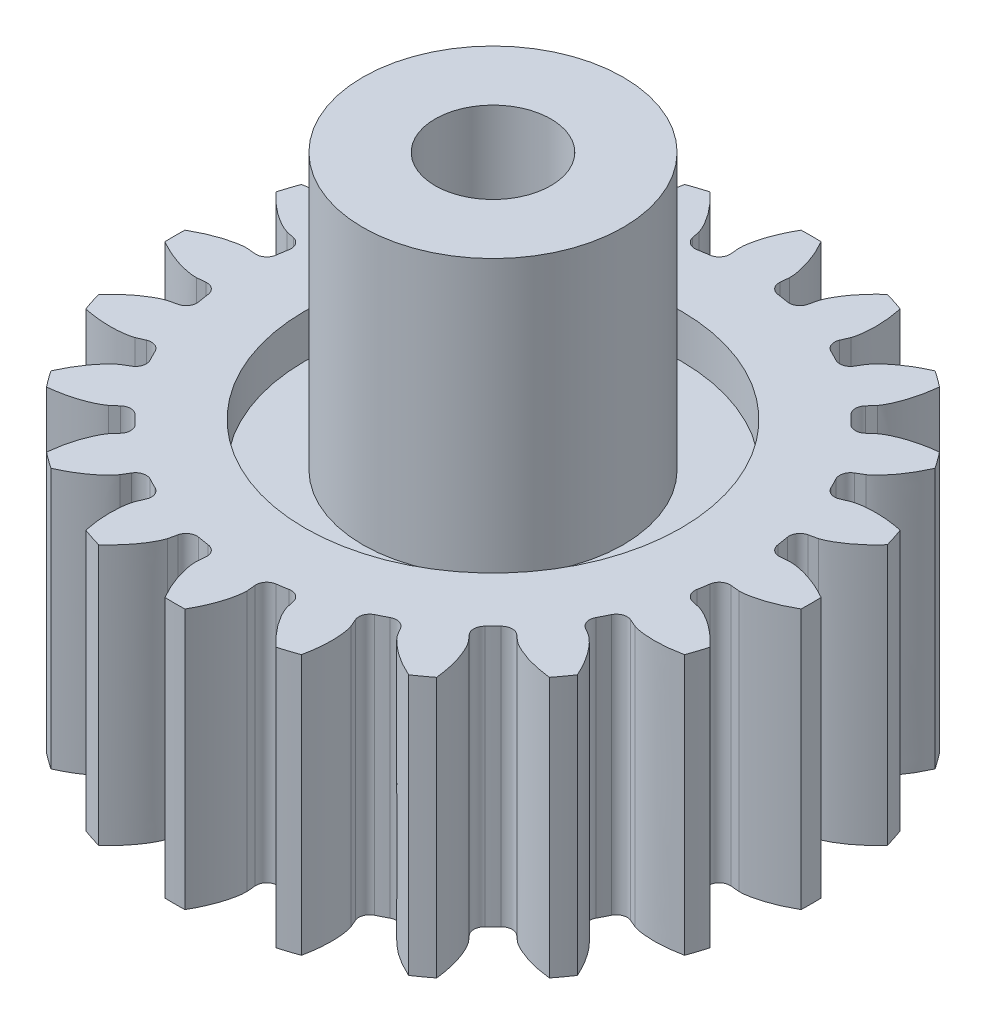
from build123d import *

# Parameters (mm, degrees)
BOSS_EXTRUDE1_DEPTH      = 4.5
BOSS_EXTRUDE1_DEPTH_BACK = 4.5
SKETCH3_R                = 4.5
BOSS_EXTRUDE2_DEPTH      = 8
CUT_EXTRUDE1_START       = -1.5
SKETCH4_R                = 6.5
SKETCH4_R_2              = 4.5
CUT_EXTRUDE1_DEPTH       = 1.5
SKETCH5_R                = 6.5
SKETCH5_R_2              = 4.5
CUT_EXTRUDE2_DEPTH       = 1.5
CUT_EXTRUDE3_REACH       = 25.043
SKETCH6_R                = 2


with BuildPart() as part:
    # Sketch1 → Boss-Extrude1 (new, two sides: drawn at the far end of the back side and taken through both)
    with BuildSketch(Plane(origin=(0, 0, 9), x_dir=(1, 0, 0), z_dir=(0, -1, 0)).offset(-BOSS_EXTRUDE1_DEPTH_BACK)):
        with BuildLine():
            Line((9.077514954, -9.850718674), (9.373356247, -9.877731455))
            add(Edge.make_bspline(
                [(9.373356247, -9.877731455), (9.508835237, -9.88009169), (9.644479833, -9.858420187), (9.777139327, -9.830823337), (9.988668533, -9.7868194), (10.195948863, -9.719946146), (10.396302265, -9.639079182), (10.602141578, -9.555997985), (10.802046528, -9.457086754), (10.99447564, -9.346437106)],
                knots=[0, 0, 0, 0, 0.000406499, 0.000406499, 0.000406499, 0.001055018, 0.001055018, 0.001055018, 0.001720678, 0.001720678, 0.001720678, 0.001720678], degree=3))
            ThreePointArc((10.99447564, -9.346437106), (10.999932388, -9), (10.99447564, -8.653562894))
            add(Edge.make_bspline(
                [(10.99447564, -8.653562894), (10.752270962, -8.514291543), (10.497928619, -8.39329861), (10.234747445, -8.299515432), (10.097780271, -8.250707926), (9.9578861, -8.209054212), (9.815942385, -8.177523892), (9.670805988, -8.145284374), (9.522007697, -8.119678827), (9.373356247, -8.122268545)],
                knots=[0, 0, 0, 0, 0.000838175, 0.000838175, 0.000838175, 0.001273222, 0.001273222, 0.001273222, 0.001719104, 0.001719104, 0.001719104, 0.001719104], degree=3))
            Line((9.373356247, -8.122268545), (9.077514954, -8.149281326))
            ThreePointArc((9.077514954, -8.149281326), (8.809362027, -8.069618554), (8.670954474, -7.826522896))
            ThreePointArc((8.670954474, -7.826522896), (8.64227298, -7.631198431), (8.609192122, -7.436570756))
            ThreePointArc((8.609192122, -7.436570756), (8.665704839, -7.162602761), (8.896116276, -7.003975151))
            Line((8.896116276, -7.003975151), (9.185825474, -6.938245845))
            add(Edge.make_bspline(
                [(9.185825474, -6.938245845), (9.315403003, -6.898625252), (9.437711817, -6.836097943), (9.555350598, -6.76885774), (9.742928864, -6.66164139), (9.9193992, -6.533988001), (10.084957342, -6.395166342), (10.25504866, -6.252543582), (10.414604315, -6.096699385), (10.563422654, -5.93200145)],
                knots=[0, 0, 0, 0, 0.000406499, 0.000406499, 0.000406499, 0.001055018, 0.001055018, 0.001055018, 0.001720678, 0.001720678, 0.001720678, 0.001720678], degree=3))
            ThreePointArc((10.563422654, -5.93200145), (10.461557376, -5.600833955), (10.349312748, -5.273038916))
            add(Edge.make_bspline(
                [(10.349312748, -5.273038916), (10.075925196, -5.215429352), (9.796642381, -5.178954341), (9.517361614, -5.171088694), (9.372015742, -5.166995181), (9.226096774, -5.170609821), (9.081356874, -5.184485726), (8.933361399, -5.198673735), (8.783933266, -5.220302613), (8.643357602, -5.268701406)],
                knots=[0, 0, 0, 0, 0.000838175, 0.000838175, 0.000838175, 0.001273222, 0.001273222, 0.001273222, 0.001719104, 0.001719104, 0.001719104, 0.001719104], degree=3))
            Line((8.643357602, -5.268701406), (8.370343221, -5.385812074))
            ThreePointArc((8.370343221, -5.385812074), (8.090697482, -5.392912087), (7.883943387, -5.204484664))
            ThreePointArc((7.883943387, -5.204484664), (7.796307087, -5.027583127), (7.704702062, -4.852703756))
            ThreePointArc((7.704702062, -4.852703756), (7.673788083, -4.57468132), (7.843903755, -4.352616448))
            Line((7.843903755, -4.352616448), (8.099122103, -4.200579097))
            add(Edge.make_bspline(
                [(8.099122103, -4.200579097), (8.210114219, -4.122856015), (8.307114813, -4.025593508), (8.398217576, -3.925291893), (8.543483434, -3.765358212), (8.671869631, -3.589420293), (8.786426529, -3.406232769), (8.904120129, -3.218029356), (9.007708068, -3.020507308), (9.098348259, -2.817882868)],
                knots=[0, 0, 0, 0, 0.000406499, 0.000406499, 0.000406499, 0.001055018, 0.001055018, 0.001055018, 0.001720678, 0.001720678, 0.001720678, 0.001720678], degree=3))
            ThreePointArc((9.098348259, -2.817882868), (8.899132239, -2.534401966), (8.691087015, -2.257335856))
            add(Edge.make_bspline(
                [(8.691087015, -2.257335856), (8.413277669, -2.287027304), (8.136392529, -2.338640643), (7.868350118, -2.417462472), (7.728853014, -2.458483654), (7.591192814, -2.507012822), (7.457824879, -2.56493668), (7.321457154, -2.624163396), (7.186026245, -2.690909514), (7.067286893, -2.78037977)],
                knots=[0, 0, 0, 0, 0.000838175, 0.000838175, 0.000838175, 0.001273222, 0.001273222, 0.001273222, 0.001719104, 0.001719104, 0.001719104, 0.001719104], degree=3))
            Line((7.067286893, -2.78037977), (6.843823974, -2.976124718))
            ThreePointArc((6.843823974, -2.976124718), (6.580059096, -3.069292517), (6.325196991, -2.953977918))
            ThreePointArc((6.325196991, -2.953977918), (6.187184335, -2.812815665), (6.046022082, -2.674803009))
            ThreePointArc((6.046022082, -2.674803009), (5.930707483, -2.419940904), (6.023875282, -2.156176026))
            Line((6.023875282, -2.156176026), (6.21962023, -1.932713107))
            add(Edge.make_bspline(
                [(6.21962023, -1.932713107), (6.301162252, -1.824495613), (6.363359531, -1.70201864), (6.419008504, -1.578473833), (6.50774232, -1.381478245), (6.575477042, -1.174477823), (6.627819068, -0.964856107), (6.681594281, -0.749494703), (6.719074596, -0.529629638), (6.742664144, -0.308912985)],
                knots=[0, 0, 0, 0, 0.000406499, 0.000406499, 0.000406499, 0.001055018, 0.001055018, 0.001055018, 0.001720678, 0.001720678, 0.001720678, 0.001720678], degree=3))
            ThreePointArc((6.742664144, -0.308912985), (6.465598034, -0.100867761), (6.182117132, 0.098348259))
            add(Edge.make_bspline(
                [(6.182117132, 0.098348259), (5.927079905, -0.015737796), (5.679695887, -0.150387212), (5.449129689, -0.308180886), (5.329136303, -0.390301325), (5.21321001, -0.478994648), (5.104269023, -0.575296468), (4.992877671, -0.673764367), (4.884700907, -0.77909415), (4.799420903, -0.900877897)],
                knots=[0, 0, 0, 0, 0.000838175, 0.000838175, 0.000838175, 0.001273222, 0.001273222, 0.001273222, 0.001719104, 0.001719104, 0.001719104, 0.001719104], degree=3))
            Line((4.799420903, -0.900877897), (4.647383552, -1.156096245))
            ThreePointArc((4.647383552, -1.156096245), (4.42531868, -1.326211917), (4.147296244, -1.295297938))
            ThreePointArc((4.147296244, -1.295297938), (3.972416873, -1.203692913), (3.795515336, -1.116056613))
            ThreePointArc((3.795515336, -1.116056613), (3.607087913, -0.909302518), (3.614187926, -0.629656779))
            Line((3.614187926, -0.629656779), (3.731298594, -0.356642398))
            add(Edge.make_bspline(
                [(3.731298594, -0.356642398), (3.775408621, -0.228523575), (3.796714283, -0.092821035), (3.811462156, 0.041873537), (3.834978046, 0.256647732), (3.835430946, 0.474448012), (3.820434499, 0.689984687), (3.805027431, 0.911423008), (3.772731287, 1.132109165), (3.726961084, 1.349312748)],
                knots=[0, 0, 0, 0, 0.000406499, 0.000406499, 0.000406499, 0.001055018, 0.001055018, 0.001055018, 0.001720678, 0.001720678, 0.001720678, 0.001720678], degree=3))
            ThreePointArc((3.726961084, 1.349312748), (3.399166045, 1.461557376), (3.06799855, 1.563422654))
            add(Edge.make_bspline(
                [(3.06799855, 1.563422654), (2.860698263, 1.376109531), (2.667031039, 1.171604461), (2.496510481, 0.950284885), (2.4077666, 0.835103711), (2.324921887, 0.714928154), (2.251071751, 0.589675063), (2.175560534, 0.461604706), (2.105227011, 0.328001671), (2.061754155, 0.185825474)],
                knots=[0, 0, 0, 0, 0.000838175, 0.000838175, 0.000838175, 0.001273222, 0.001273222, 0.001273222, 0.001719104, 0.001719104, 0.001719104, 0.001719104], degree=3))
            Line((2.061754155, 0.185825474), (1.996024849, -0.103883724))
            ThreePointArc((1.996024849, -0.103883724), (1.837397239, -0.334295161), (1.563429244, -0.390807878))
            ThreePointArc((1.563429244, -0.390807878), (1.368801569, -0.35772702), (1.173477104, -0.329045526))
            ThreePointArc((1.173477104, -0.329045526), (0.930381446, -0.190637973), (0.850718674, 0.077514954))
            Line((0.850718674, 0.077514954), (0.877731455, 0.373356247))
            add(Edge.make_bspline(
                [(0.877731455, 0.373356247), (0.88009169, 0.508835237), (0.858420187, 0.644479833), (0.830823337, 0.777139327), (0.7868194, 0.988668533), (0.719946146, 1.195948863), (0.639079182, 1.396302265), (0.555997985, 1.602141578), (0.457086754, 1.802046528), (0.346437106, 1.99447564)],
                knots=[0, 0, 0, 0, 0.000406499, 0.000406499, 0.000406499, 0.001055018, 0.001055018, 0.001055018, 0.001720678, 0.001720678, 0.001720678, 0.001720678], degree=3))
            ThreePointArc((0.346437106, 1.99447564), (0, 1.999932388), (-0.346437106, 1.99447564))
            add(Edge.make_bspline(
                [(-0.346437106, 1.99447564), (-0.485708457, 1.752270962), (-0.60670139, 1.497928619), (-0.700484568, 1.234747445), (-0.749292074, 1.097780271), (-0.790945788, 0.9578861), (-0.822476108, 0.815942385), (-0.854715626, 0.670805988), (-0.880321173, 0.522007697), (-0.877731455, 0.373356247)],
                knots=[0, 0, 0, 0, 0.000838175, 0.000838175, 0.000838175, 0.001273222, 0.001273222, 0.001273222, 0.001719104, 0.001719104, 0.001719104, 0.001719104], degree=3))
            Line((-0.877731455, 0.373356247), (-0.850718674, 0.077514954))
            ThreePointArc((-0.850718674, 0.077514954), (-0.930381446, -0.190637973), (-1.173477104, -0.329045526))
            ThreePointArc((-1.173477104, -0.329045526), (-1.368801569, -0.35772702), (-1.563429244, -0.390807878))
            ThreePointArc((-1.563429244, -0.390807878), (-1.837397239, -0.334295161), (-1.996024849, -0.103883724))
            Line((-1.996024849, -0.103883724), (-2.061754155, 0.185825474))
            add(Edge.make_bspline(
                [(-2.061754155, 0.185825474), (-2.101374748, 0.315403003), (-2.163902057, 0.437711817), (-2.23114226, 0.555350598), (-2.33835861, 0.742928864), (-2.466011999, 0.9193992), (-2.604833658, 1.084957342), (-2.747456418, 1.25504866), (-2.903300615, 1.414604315), (-3.06799855, 1.563422654)],
                knots=[0, 0, 0, 0, 0.000406499, 0.000406499, 0.000406499, 0.001055018, 0.001055018, 0.001055018, 0.001720678, 0.001720678, 0.001720678, 0.001720678], degree=3))
            ThreePointArc((-3.06799855, 1.563422654), (-3.399166045, 1.461557376), (-3.726961084, 1.349312748))
            add(Edge.make_bspline(
                [(-3.726961084, 1.349312748), (-3.784570648, 1.075925196), (-3.821045659, 0.796642381), (-3.828911306, 0.517361614), (-3.833004819, 0.372015742), (-3.829390179, 0.226096774), (-3.815514274, 0.081356874), (-3.801326265, -0.066638601), (-3.779697387, -0.216066734), (-3.731298594, -0.356642398)],
                knots=[0, 0, 0, 0, 0.000838175, 0.000838175, 0.000838175, 0.001273222, 0.001273222, 0.001273222, 0.001719104, 0.001719104, 0.001719104, 0.001719104], degree=3))
            Line((-3.731298594, -0.356642398), (-3.614187926, -0.629656779))
            ThreePointArc((-3.614187926, -0.629656779), (-3.607087913, -0.909302518), (-3.795515336, -1.116056613))
            ThreePointArc((-3.795515336, -1.116056613), (-3.972416873, -1.203692913), (-4.147296244, -1.295297938))
            ThreePointArc((-4.147296244, -1.295297938), (-4.42531868, -1.326211917), (-4.647383552, -1.156096245))
            Line((-4.647383552, -1.156096245), (-4.799420903, -0.900877897))
            add(Edge.make_bspline(
                [(-4.799420903, -0.900877897), (-4.877143985, -0.789885781), (-4.974406492, -0.692885187), (-5.074708107, -0.601782424), (-5.234641788, -0.456516566), (-5.410579707, -0.328130369), (-5.593767231, -0.213573471), (-5.781970644, -0.095879871), (-5.979492692, 0.007708068), (-6.182117132, 0.098348259)],
                knots=[0, 0, 0, 0, 0.000406499, 0.000406499, 0.000406499, 0.001055018, 0.001055018, 0.001055018, 0.001720678, 0.001720678, 0.001720678, 0.001720678], degree=3))
            ThreePointArc((-6.182117132, 0.098348259), (-6.465598034, -0.100867761), (-6.742664144, -0.308912985))
            add(Edge.make_bspline(
                [(-6.742664144, -0.308912985), (-6.712972696, -0.586722331), (-6.661359357, -0.863607471), (-6.582537528, -1.131649882), (-6.541516346, -1.271146986), (-6.492987178, -1.408807186), (-6.43506332, -1.542175121), (-6.375836604, -1.678542846), (-6.309090486, -1.813973755), (-6.21962023, -1.932713107)],
                knots=[0, 0, 0, 0, 0.000838175, 0.000838175, 0.000838175, 0.001273222, 0.001273222, 0.001273222, 0.001719104, 0.001719104, 0.001719104, 0.001719104], degree=3))
            Line((-6.21962023, -1.932713107), (-6.023875282, -2.156176026))
            ThreePointArc((-6.023875282, -2.156176026), (-5.930707483, -2.419940904), (-6.046022082, -2.674803009))
            ThreePointArc((-6.046022082, -2.674803009), (-6.187184335, -2.812815665), (-6.325196991, -2.953977918))
            ThreePointArc((-6.325196991, -2.953977918), (-6.580059096, -3.069292517), (-6.843823974, -2.976124718))
            Line((-6.843823974, -2.976124718), (-7.067286893, -2.78037977))
            add(Edge.make_bspline(
                [(-7.067286893, -2.78037977), (-7.175504387, -2.698837748), (-7.29798136, -2.636640469), (-7.421526167, -2.580991496), (-7.618521755, -2.49225768), (-7.825522177, -2.424522958), (-8.035143893, -2.372180932), (-8.250505297, -2.318405719), (-8.470370362, -2.280925404), (-8.691087015, -2.257335856)],
                knots=[0, 0, 0, 0, 0.000406499, 0.000406499, 0.000406499, 0.001055018, 0.001055018, 0.001055018, 0.001720678, 0.001720678, 0.001720678, 0.001720678], degree=3))
            ThreePointArc((-8.691087015, -2.257335856), (-8.899132239, -2.534401966), (-9.098348259, -2.817882868))
            add(Edge.make_bspline(
                [(-9.098348259, -2.817882868), (-8.984262204, -3.072920095), (-8.849612788, -3.320304113), (-8.691819114, -3.550870311), (-8.609698675, -3.670863697), (-8.521005352, -3.78678999), (-8.424703532, -3.895730977), (-8.326235633, -4.007122329), (-8.22090585, -4.115299093), (-8.099122103, -4.200579097)],
                knots=[0, 0, 0, 0, 0.000838175, 0.000838175, 0.000838175, 0.001273222, 0.001273222, 0.001273222, 0.001719104, 0.001719104, 0.001719104, 0.001719104], degree=3))
            Line((-8.099122103, -4.200579097), (-7.843903755, -4.352616448))
            ThreePointArc((-7.843903755, -4.352616448), (-7.673788083, -4.57468132), (-7.704702062, -4.852703756))
            ThreePointArc((-7.704702062, -4.852703756), (-7.796307087, -5.027583127), (-7.883943387, -5.204484664))
            ThreePointArc((-7.883943387, -5.204484664), (-8.090697482, -5.392912087), (-8.370343221, -5.385812074))
            Line((-8.370343221, -5.385812074), (-8.643357602, -5.268701406))
            add(Edge.make_bspline(
                [(-8.643357602, -5.268701406), (-8.771476425, -5.224591379), (-8.907178965, -5.203285717), (-9.041873537, -5.188537844), (-9.256647732, -5.165021954), (-9.474448012, -5.164569054), (-9.689984687, -5.179565501), (-9.911423008, -5.194972569), (-10.132109165, -5.227268713), (-10.349312748, -5.273038916)],
                knots=[0, 0, 0, 0, 0.000406499, 0.000406499, 0.000406499, 0.001055018, 0.001055018, 0.001055018, 0.001720678, 0.001720678, 0.001720678, 0.001720678], degree=3))
            ThreePointArc((-10.349312748, -5.273038916), (-10.461557376, -5.600833955), (-10.563422654, -5.93200145))
            add(Edge.make_bspline(
                [(-10.563422654, -5.93200145), (-10.376109531, -6.139301737), (-10.171604461, -6.332968961), (-9.950284885, -6.503489519), (-9.835103711, -6.5922334), (-9.714928154, -6.675078113), (-9.589675063, -6.748928249), (-9.461604706, -6.824439466), (-9.328001671, -6.894772989), (-9.185825474, -6.938245845)],
                knots=[0, 0, 0, 0, 0.000838175, 0.000838175, 0.000838175, 0.001273222, 0.001273222, 0.001273222, 0.001719104, 0.001719104, 0.001719104, 0.001719104], degree=3))
            Line((-9.185825474, -6.938245845), (-8.896116276, -7.003975151))
            ThreePointArc((-8.896116276, -7.003975151), (-8.665704839, -7.162602761), (-8.609192122, -7.436570756))
            ThreePointArc((-8.609192122, -7.436570756), (-8.64227298, -7.631198431), (-8.670954474, -7.826522896))
            ThreePointArc((-8.670954474, -7.826522896), (-8.809362027, -8.069618554), (-9.077514954, -8.149281326))
            Line((-9.077514954, -8.149281326), (-9.373356247, -8.122268545))
            add(Edge.make_bspline(
                [(-9.373356247, -8.122268545), (-9.508835237, -8.11990831), (-9.644479833, -8.141579813), (-9.777139327, -8.169176663), (-9.988668533, -8.2131806), (-10.195948863, -8.280053854), (-10.396302265, -8.360920818), (-10.602141578, -8.444002015), (-10.802046528, -8.542913246), (-10.99447564, -8.653562894)],
                knots=[0, 0, 0, 0, 0.000406499, 0.000406499, 0.000406499, 0.001055018, 0.001055018, 0.001055018, 0.001720678, 0.001720678, 0.001720678, 0.001720678], degree=3))
            ThreePointArc((-10.99447564, -8.653562894), (-10.999932388, -9), (-10.99447564, -9.346437106))
            add(Edge.make_bspline(
                [(-10.99447564, -9.346437106), (-10.752270962, -9.485708457), (-10.497928619, -9.60670139), (-10.234747445, -9.700484568), (-10.097780271, -9.749292074), (-9.9578861, -9.790945788), (-9.815942385, -9.822476108), (-9.670805988, -9.854715626), (-9.522007697, -9.880321173), (-9.373356247, -9.877731455)],
                knots=[0, 0, 0, 0, 0.000838175, 0.000838175, 0.000838175, 0.001273222, 0.001273222, 0.001273222, 0.001719104, 0.001719104, 0.001719104, 0.001719104], degree=3))
            Line((-9.373356247, -9.877731455), (-9.077514954, -9.850718674))
            ThreePointArc((-9.077514954, -9.850718674), (-8.809362027, -9.930381446), (-8.670954474, -10.173477104))
            ThreePointArc((-8.670954474, -10.173477104), (-8.64227298, -10.368801569), (-8.609192122, -10.563429244))
            ThreePointArc((-8.609192122, -10.563429244), (-8.665704839, -10.837397239), (-8.896116276, -10.996024849))
            Line((-8.896116276, -10.996024849), (-9.185825474, -11.061754155))
            add(Edge.make_bspline(
                [(-9.185825474, -11.061754155), (-9.315403003, -11.101374748), (-9.437711817, -11.163902057), (-9.555350598, -11.23114226), (-9.742928864, -11.33835861), (-9.9193992, -11.466011999), (-10.084957342, -11.604833658), (-10.25504866, -11.747456418), (-10.414604315, -11.903300615), (-10.563422654, -12.06799855)],
                knots=[0, 0, 0, 0, 0.000406499, 0.000406499, 0.000406499, 0.001055018, 0.001055018, 0.001055018, 0.001720678, 0.001720678, 0.001720678, 0.001720678], degree=3))
            ThreePointArc((-10.563422654, -12.06799855), (-10.461557376, -12.399166045), (-10.349312748, -12.726961084))
            add(Edge.make_bspline(
                [(-10.349312748, -12.726961084), (-10.075925196, -12.784570648), (-9.796642381, -12.821045659), (-9.517361614, -12.828911306), (-9.372015742, -12.833004819), (-9.226096774, -12.829390179), (-9.081356874, -12.815514274), (-8.933361399, -12.801326265), (-8.783933266, -12.779697387), (-8.643357602, -12.731298594)],
                knots=[0, 0, 0, 0, 0.000838175, 0.000838175, 0.000838175, 0.001273222, 0.001273222, 0.001273222, 0.001719104, 0.001719104, 0.001719104, 0.001719104], degree=3))
            Line((-8.643357602, -12.731298594), (-8.370343221, -12.614187926))
            ThreePointArc((-8.370343221, -12.614187926), (-8.090697482, -12.607087913), (-7.883943387, -12.795515336))
            ThreePointArc((-7.883943387, -12.795515336), (-7.796307087, -12.972416873), (-7.704702062, -13.147296244))
            ThreePointArc((-7.704702062, -13.147296244), (-7.673788083, -13.42531868), (-7.843903755, -13.647383552))
            Line((-7.843903755, -13.647383552), (-8.099122103, -13.799420903))
            add(Edge.make_bspline(
                [(-8.099122103, -13.799420903), (-8.210114219, -13.877143985), (-8.307114813, -13.974406492), (-8.398217576, -14.074708107), (-8.543483434, -14.234641788), (-8.671869631, -14.410579707), (-8.786426529, -14.593767231), (-8.904120129, -14.781970644), (-9.007708068, -14.979492692), (-9.098348259, -15.182117132)],
                knots=[0, 0, 0, 0, 0.000406499, 0.000406499, 0.000406499, 0.001055018, 0.001055018, 0.001055018, 0.001720678, 0.001720678, 0.001720678, 0.001720678], degree=3))
            ThreePointArc((-9.098348259, -15.182117132), (-8.899132239, -15.465598034), (-8.691087015, -15.742664144))
            add(Edge.make_bspline(
                [(-8.691087015, -15.742664144), (-8.413277669, -15.712972696), (-8.136392529, -15.661359357), (-7.868350118, -15.582537528), (-7.728853014, -15.541516346), (-7.591192814, -15.492987178), (-7.457824879, -15.43506332), (-7.321457154, -15.375836604), (-7.186026245, -15.309090486), (-7.067286893, -15.21962023)],
                knots=[0, 0, 0, 0, 0.000838175, 0.000838175, 0.000838175, 0.001273222, 0.001273222, 0.001273222, 0.001719104, 0.001719104, 0.001719104, 0.001719104], degree=3))
            Line((-7.067286893, -15.21962023), (-6.843823974, -15.023875282))
            ThreePointArc((-6.843823974, -15.023875282), (-6.580059096, -14.930707483), (-6.325196991, -15.046022082))
            ThreePointArc((-6.325196991, -15.046022082), (-6.187184335, -15.187184335), (-6.046022082, -15.325196991))
            ThreePointArc((-6.046022082, -15.325196991), (-5.930707483, -15.580059096), (-6.023875282, -15.843823974))
            Line((-6.023875282, -15.843823974), (-6.21962023, -16.067286893))
            add(Edge.make_bspline(
                [(-6.21962023, -16.067286893), (-6.301162252, -16.175504387), (-6.363359531, -16.29798136), (-6.419008504, -16.421526167), (-6.50774232, -16.618521755), (-6.575477042, -16.825522177), (-6.627819068, -17.035143893), (-6.681594281, -17.250505297), (-6.719074596, -17.470370362), (-6.742664144, -17.691087015)],
                knots=[0, 0, 0, 0, 0.000406499, 0.000406499, 0.000406499, 0.001055018, 0.001055018, 0.001055018, 0.001720678, 0.001720678, 0.001720678, 0.001720678], degree=3))
            ThreePointArc((-6.742664144, -17.691087015), (-6.465598034, -17.899132239), (-6.182117132, -18.098348259))
            add(Edge.make_bspline(
                [(-6.182117132, -18.098348259), (-5.927079905, -17.984262204), (-5.679695887, -17.849612788), (-5.449129689, -17.691819114), (-5.329136303, -17.609698675), (-5.21321001, -17.521005352), (-5.104269023, -17.424703532), (-4.992877671, -17.326235633), (-4.884700907, -17.22090585), (-4.799420903, -17.099122103)],
                knots=[0, 0, 0, 0, 0.000838175, 0.000838175, 0.000838175, 0.001273222, 0.001273222, 0.001273222, 0.001719104, 0.001719104, 0.001719104, 0.001719104], degree=3))
            Line((-4.799420903, -17.099122103), (-4.647383552, -16.843903755))
            ThreePointArc((-4.647383552, -16.843903755), (-4.42531868, -16.673788083), (-4.147296244, -16.704702062))
            ThreePointArc((-4.147296244, -16.704702062), (-3.972416873, -16.796307087), (-3.795515336, -16.883943387))
            ThreePointArc((-3.795515336, -16.883943387), (-3.607087913, -17.090697482), (-3.614187926, -17.370343221))
            Line((-3.614187926, -17.370343221), (-3.731298594, -17.643357602))
            add(Edge.make_bspline(
                [(-3.731298594, -17.643357602), (-3.775408621, -17.771476425), (-3.796714283, -17.907178965), (-3.811462156, -18.041873537), (-3.834978046, -18.256647732), (-3.835430946, -18.474448012), (-3.820434499, -18.689984687), (-3.805027431, -18.911423008), (-3.772731287, -19.132109165), (-3.726961084, -19.349312748)],
                knots=[0, 0, 0, 0, 0.000406499, 0.000406499, 0.000406499, 0.001055018, 0.001055018, 0.001055018, 0.001720678, 0.001720678, 0.001720678, 0.001720678], degree=3))
            ThreePointArc((-3.726961084, -19.349312748), (-3.399166045, -19.461557376), (-3.06799855, -19.563422654))
            add(Edge.make_bspline(
                [(-3.06799855, -19.563422654), (-2.860698263, -19.376109531), (-2.667031039, -19.171604461), (-2.496510481, -18.950284885), (-2.4077666, -18.835103711), (-2.324921887, -18.714928154), (-2.251071751, -18.589675063), (-2.175560534, -18.461604706), (-2.105227011, -18.328001671), (-2.061754155, -18.185825474)],
                knots=[0, 0, 0, 0, 0.000838175, 0.000838175, 0.000838175, 0.001273222, 0.001273222, 0.001273222, 0.001719104, 0.001719104, 0.001719104, 0.001719104], degree=3))
            Line((-2.061754155, -18.185825474), (-1.996024849, -17.896116276))
            ThreePointArc((-1.996024849, -17.896116276), (-1.837397239, -17.665704839), (-1.563429244, -17.609192122))
            ThreePointArc((-1.563429244, -17.609192122), (-1.368801569, -17.64227298), (-1.173477104, -17.670954474))
            ThreePointArc((-1.173477104, -17.670954474), (-0.930381446, -17.809362027), (-0.850718674, -18.077514954))
            Line((-0.850718674, -18.077514954), (-0.877731455, -18.373356247))
            add(Edge.make_bspline(
                [(-0.877731455, -18.373356247), (-0.88009169, -18.508835237), (-0.858420187, -18.644479833), (-0.830823337, -18.777139327), (-0.7868194, -18.988668533), (-0.719946146, -19.195948863), (-0.639079182, -19.396302265), (-0.555997985, -19.602141578), (-0.457086754, -19.802046528), (-0.346437106, -19.99447564)],
                knots=[0, 0, 0, 0, 0.000406499, 0.000406499, 0.000406499, 0.001055018, 0.001055018, 0.001055018, 0.001720678, 0.001720678, 0.001720678, 0.001720678], degree=3))
            ThreePointArc((-0.346437106, -19.99447564), (0, -19.999932388), (0.346437106, -19.99447564))
            add(Edge.make_bspline(
                [(0.346437106, -19.99447564), (0.485708457, -19.752270962), (0.60670139, -19.497928619), (0.700484568, -19.234747445), (0.749292074, -19.097780271), (0.790945788, -18.9578861), (0.822476108, -18.815942385), (0.854715626, -18.670805988), (0.880321173, -18.522007697), (0.877731455, -18.373356247)],
                knots=[0, 0, 0, 0, 0.000838175, 0.000838175, 0.000838175, 0.001273222, 0.001273222, 0.001273222, 0.001719104, 0.001719104, 0.001719104, 0.001719104], degree=3))
            Line((0.877731455, -18.373356247), (0.850718674, -18.077514954))
            ThreePointArc((0.850718674, -18.077514954), (0.930381446, -17.809362027), (1.173477104, -17.670954474))
            ThreePointArc((1.173477104, -17.670954474), (1.368801569, -17.64227298), (1.563429244, -17.609192122))
            ThreePointArc((1.563429244, -17.609192122), (1.837397239, -17.665704839), (1.996024849, -17.896116276))
            Line((1.996024849, -17.896116276), (2.061754155, -18.185825474))
            add(Edge.make_bspline(
                [(2.061754155, -18.185825474), (2.101374748, -18.315403003), (2.163902057, -18.437711817), (2.23114226, -18.555350598), (2.33835861, -18.742928864), (2.466011999, -18.9193992), (2.604833658, -19.084957342), (2.747456418, -19.25504866), (2.903300615, -19.414604315), (3.06799855, -19.563422654)],
                knots=[0, 0, 0, 0, 0.000406499, 0.000406499, 0.000406499, 0.001055018, 0.001055018, 0.001055018, 0.001720678, 0.001720678, 0.001720678, 0.001720678], degree=3))
            ThreePointArc((3.06799855, -19.563422654), (3.399166045, -19.461557376), (3.726961084, -19.349312748))
            add(Edge.make_bspline(
                [(3.726961084, -19.349312748), (3.784570648, -19.075925196), (3.821045659, -18.796642381), (3.828911306, -18.517361614), (3.833004819, -18.372015742), (3.829390179, -18.226096774), (3.815514274, -18.081356874), (3.801326265, -17.933361399), (3.779697387, -17.783933266), (3.731298594, -17.643357602)],
                knots=[0, 0, 0, 0, 0.000838175, 0.000838175, 0.000838175, 0.001273222, 0.001273222, 0.001273222, 0.001719104, 0.001719104, 0.001719104, 0.001719104], degree=3))
            Line((3.731298594, -17.643357602), (3.614187926, -17.370343221))
            ThreePointArc((3.614187926, -17.370343221), (3.607087913, -17.090697482), (3.795515336, -16.883943387))
            ThreePointArc((3.795515336, -16.883943387), (3.972416873, -16.796307087), (4.147296244, -16.704702062))
            ThreePointArc((4.147296244, -16.704702062), (4.42531868, -16.673788083), (4.647383552, -16.843903755))
            Line((4.647383552, -16.843903755), (4.799420903, -17.099122103))
            add(Edge.make_bspline(
                [(4.799420903, -17.099122103), (4.877143985, -17.210114219), (4.974406492, -17.307114813), (5.074708107, -17.398217576), (5.234641788, -17.543483434), (5.410579707, -17.671869631), (5.593767231, -17.786426529), (5.781970644, -17.904120129), (5.979492692, -18.007708068), (6.182117132, -18.098348259)],
                knots=[0, 0, 0, 0, 0.000406499, 0.000406499, 0.000406499, 0.001055018, 0.001055018, 0.001055018, 0.001720678, 0.001720678, 0.001720678, 0.001720678], degree=3))
            ThreePointArc((6.182117132, -18.098348259), (6.465598034, -17.899132239), (6.742664144, -17.691087015))
            add(Edge.make_bspline(
                [(6.742664144, -17.691087015), (6.712972696, -17.413277669), (6.661359357, -17.136392529), (6.582537528, -16.868350118), (6.541516346, -16.728853014), (6.492987178, -16.591192814), (6.43506332, -16.457824879), (6.375836604, -16.321457154), (6.309090486, -16.186026245), (6.21962023, -16.067286893)],
                knots=[0, 0, 0, 0, 0.000838175, 0.000838175, 0.000838175, 0.001273222, 0.001273222, 0.001273222, 0.001719104, 0.001719104, 0.001719104, 0.001719104], degree=3))
            Line((6.21962023, -16.067286893), (6.023875282, -15.843823974))
            ThreePointArc((6.023875282, -15.843823974), (5.930707483, -15.580059096), (6.046022082, -15.325196991))
            ThreePointArc((6.046022082, -15.325196991), (6.187184335, -15.187184335), (6.325196991, -15.046022082))
            ThreePointArc((6.325196991, -15.046022082), (6.580059096, -14.930707483), (6.843823974, -15.023875282))
            Line((6.843823974, -15.023875282), (7.067286893, -15.21962023))
            add(Edge.make_bspline(
                [(7.067286893, -15.21962023), (7.175504387, -15.301162252), (7.29798136, -15.363359531), (7.421526167, -15.419008504), (7.618521755, -15.50774232), (7.825522177, -15.575477042), (8.035143893, -15.627819068), (8.250505297, -15.681594281), (8.470370362, -15.719074596), (8.691087015, -15.742664144)],
                knots=[0, 0, 0, 0, 0.000406499, 0.000406499, 0.000406499, 0.001055018, 0.001055018, 0.001055018, 0.001720678, 0.001720678, 0.001720678, 0.001720678], degree=3))
            ThreePointArc((8.691087015, -15.742664144), (8.899132239, -15.465598034), (9.098348259, -15.182117132))
            add(Edge.make_bspline(
                [(9.098348259, -15.182117132), (8.984262204, -14.927079905), (8.849612788, -14.679695887), (8.691819114, -14.449129689), (8.609698675, -14.329136303), (8.521005352, -14.21321001), (8.424703532, -14.104269023), (8.326235633, -13.992877671), (8.22090585, -13.884700907), (8.099122103, -13.799420903)],
                knots=[0, 0, 0, 0, 0.000838175, 0.000838175, 0.000838175, 0.001273222, 0.001273222, 0.001273222, 0.001719104, 0.001719104, 0.001719104, 0.001719104], degree=3))
            Line((8.099122103, -13.799420903), (7.843903755, -13.647383552))
            ThreePointArc((7.843903755, -13.647383552), (7.673788083, -13.42531868), (7.704702062, -13.147296244))
            ThreePointArc((7.704702062, -13.147296244), (7.796307087, -12.972416873), (7.883943387, -12.795515336))
            ThreePointArc((7.883943387, -12.795515336), (8.090697482, -12.607087913), (8.370343221, -12.614187926))
            Line((8.370343221, -12.614187926), (8.643357602, -12.731298594))
            add(Edge.make_bspline(
                [(8.643357602, -12.731298594), (8.771476425, -12.775408621), (8.907178965, -12.796714283), (9.041873537, -12.811462156), (9.256647732, -12.834978046), (9.474448012, -12.835430946), (9.689984687, -12.820434499), (9.911423008, -12.805027431), (10.132109165, -12.772731287), (10.349312748, -12.726961084)],
                knots=[0, 0, 0, 0, 0.000406499, 0.000406499, 0.000406499, 0.001055018, 0.001055018, 0.001055018, 0.001720678, 0.001720678, 0.001720678, 0.001720678], degree=3))
            ThreePointArc((10.349312748, -12.726961084), (10.461557376, -12.399166045), (10.563422654, -12.06799855))
            add(Edge.make_bspline(
                [(10.563422654, -12.06799855), (10.376109531, -11.860698263), (10.171604461, -11.667031039), (9.950284885, -11.496510481), (9.835103711, -11.4077666), (9.714928154, -11.324921887), (9.589675063, -11.251071751), (9.461604706, -11.175560534), (9.328001671, -11.105227011), (9.185825474, -11.061754155)],
                knots=[0, 0, 0, 0, 0.000838175, 0.000838175, 0.000838175, 0.001273222, 0.001273222, 0.001273222, 0.001719104, 0.001719104, 0.001719104, 0.001719104], degree=3))
            Line((9.185825474, -11.061754155), (8.896116276, -10.996024849))
            ThreePointArc((8.896116276, -10.996024849), (8.665704839, -10.837397239), (8.609192122, -10.563429244))
            ThreePointArc((8.609192122, -10.563429244), (8.64227298, -10.368801569), (8.670954474, -10.173477104))
            ThreePointArc((8.670954474, -10.173477104), (8.809362027, -9.930381446), (9.077514954, -9.850718674))
        make_face()
    extrude(amount=BOSS_EXTRUDE1_DEPTH + BOSS_EXTRUDE1_DEPTH_BACK)

    # Sketch3 → Boss-Extrude2 (add)
    with BuildSketch(Plane(origin=(0, 4.5, 0), x_dir=(1, 0, 0), z_dir=(0, 1, 0))):
        Circle(SKETCH3_R)
    extrude(amount=BOSS_EXTRUDE2_DEPTH)

    # Sketch4 → Cut-Extrude1 (cut)
    with BuildSketch(Plane(origin=(0, 4.5, 0), x_dir=(1, 0, 0), z_dir=(0, 1, 0)).offset(CUT_EXTRUDE1_START)):
        Circle(SKETCH4_R)
        Circle(SKETCH4_R_2, mode=Mode.SUBTRACT)
    extrude(amount=CUT_EXTRUDE1_DEPTH, mode=Mode.SUBTRACT)

    # Sketch5 → Cut-Extrude2 (cut)
    with BuildSketch(Plane.XZ.offset(4.5)):
        Circle(SKETCH5_R)
        Circle(SKETCH5_R_2, mode=Mode.SUBTRACT)
    extrude(amount=-CUT_EXTRUDE2_DEPTH, mode=Mode.SUBTRACT)

    # Sketch6 → Cut-Extrude3 (cut, up to next)
    with BuildSketch(Plane(origin=(0, 12.5, 0), x_dir=(1, 0, 0), z_dir=(0, 1, 0)), mode=Mode.PRIVATE) as cut_extrude3_sk1:
        Circle(SKETCH6_R)
    cut_extrude3_tool1 = extrude(cut_extrude3_sk1.sketch, amount=-CUT_EXTRUDE3_REACH, mode=Mode.PRIVATE) & part.part
    add(cut_extrude3_tool1.solids().sort_by_distance((0, 12.5, 0))[0], mode=Mode.SUBTRACT)


solid = part.part
